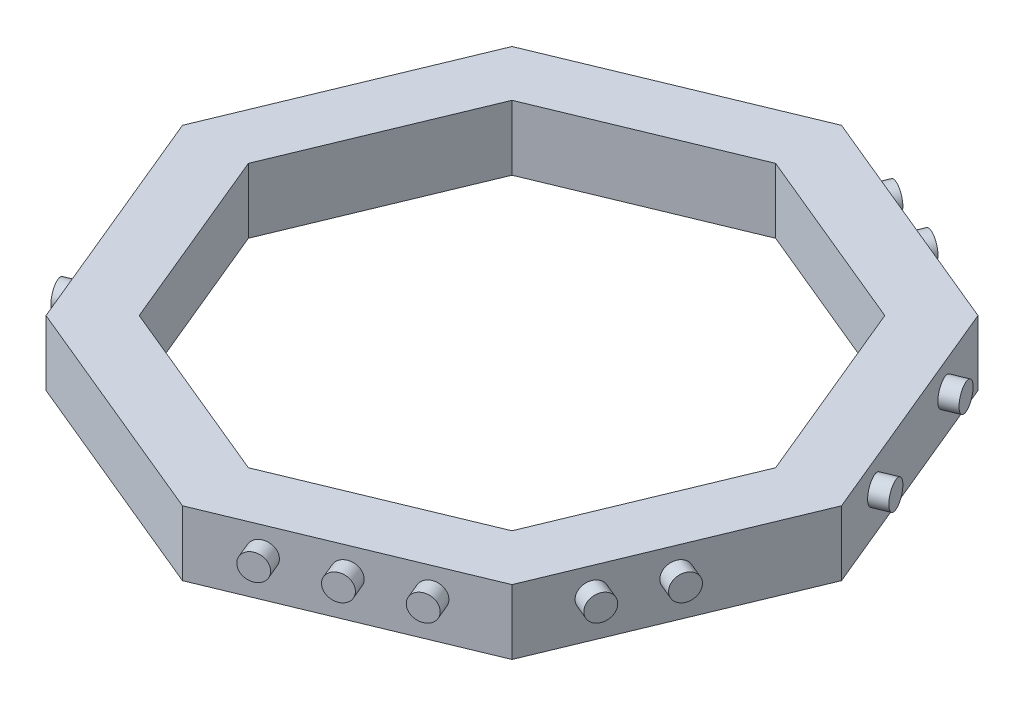
from build123d import *

# Parameters (mm, degrees)
BOSS_EXTRUDE1_DEPTH  = 5
CUT_EXTRUDE1_DEPTH   = 5
SKETCH6_R            = 1
BOSS_EXTRUDE5_DEPTH  = 1.25
SKETCH7_R            = 1
BOSS_EXTRUDE6_DEPTH  = 1.25
SKETCH8_R            = 1
BOSS_EXTRUDE7_DEPTH  = 1.25
BOSS_EXTRUDE8_START  = 1.25
SKETCH9_R            = 1
BOSS_EXTRUDE8_DEPTH  = 1.25
SKETCH10_R           = 1
BOSS_EXTRUDE12_DEPTH = 1.25
BOSS_EXTRUDE13_START = 1.25
SKETCH11_R           = 1
BOSS_EXTRUDE13_DEPTH = 1.25
BOSS_EXTRUDE14_START = 1.25
SKETCH12_R           = 1
BOSS_EXTRUDE14_DEPTH = 1.25


with BuildPart() as part:
    # Sketch3 → Boss-Extrude1 (new body)
    with BuildSketch(Plane(origin=(0, 0, 0), x_dir=(1, 0, 0), z_dir=(0, 1, 0))):
        Polygon((25.4, 0), (17.960512242, 17.960512242), (0, 25.4), (-17.960512242, 17.960512242), (-25.4, 0), (-17.960512242, -17.960512242), (0, -25.4), (17.960512242, -17.960512242), align=None)
    extrude(amount=BOSS_EXTRUDE1_DEPTH)

    # Sketch5 → Cut-Extrude1 (cut)
    with BuildSketch(Plane(origin=(0, 5, 0), x_dir=(1, 0, 0), z_dir=(0, 1, 0))):
        Polygon((20.32, 0), (14.368409794, 14.368409794), (0, 20.32), (-14.368409794, 14.368409794), (-20.32, 0), (-14.368409794, -14.368409794), (0, -20.32), (14.368409794, -14.368409794), align=None)
    extrude(amount=-CUT_EXTRUDE1_DEPTH, mode=Mode.SUBTRACT)

    # Sketch6 → Boss-Extrude5 (add)
    with BuildSketch(Plane(origin=(8.980256121, 0, 21.680256121), x_dir=(0.9238795325112827, 0, -0.38268343236509966), z_dir=(0.38268343236509966, 0, 0.9238795325112827))):
        with Locations(Location((0, 3, 0), (0, 0, 180))):
            Circle(SKETCH6_R)
        with Locations(Location((-5, 3, 0), (0, 0, 180))):
            Circle(SKETCH6_R)
        with Locations(Location((5, 3, 0), (0, 0, 180))):
            Circle(SKETCH6_R)
    extrude(amount=BOSS_EXTRUDE5_DEPTH)

    # Sketch7 → Boss-Extrude6 (add)
    with BuildSketch(Plane(origin=(-21.680256121, 0, 8.980256121), x_dir=(0.3826834323650997, 0, 0.9238795325112827), z_dir=(-0.9238795325112827, 0, 0.3826834323650997))):
        with Locations(Location((5, 3, 0), (0, 0, 180))):
            Circle(SKETCH7_R)
    extrude(amount=BOSS_EXTRUDE6_DEPTH)

    # Sketch8 → Boss-Extrude7 (add)
    with BuildSketch(Plane(origin=(-21.680256121, 0, -8.980256121), x_dir=(-0.3826834323650795, 0, 0.9238795325112911), z_dir=(-0.9238795325112911, 0, -0.3826834323650795))):
        with Locations(Location((0, 3, 0), (0, 0, 180))):
            Circle(SKETCH8_R)
    extrude(amount=BOSS_EXTRUDE7_DEPTH)

    # Sketch9 → Boss-Extrude8 (add)
    with BuildSketch(Plane(origin=(-8.980256121, 0, -21.680256121), x_dir=(-0.9238795325112826, 0, 0.38268343236509983), z_dir=(-0.38268343236509983, 0, -0.9238795325112826)).offset(BOSS_EXTRUDE8_START)):
        with Locations((-5, 3)):
            Circle(SKETCH9_R)
    extrude(amount=-BOSS_EXTRUDE8_DEPTH)

    # Sketch10 → Boss-Extrude12 (add)
    with BuildSketch(Plane(origin=(8.980256121, 0, -21.680256121), x_dir=(-0.923879532511291, 0, -0.38268343236507973), z_dir=(0.38268343236507973, 0, -0.923879532511291))):
        with Locations(Location((0, 3, 0), (0, 0, 180))):
            Circle(SKETCH10_R)
        with Locations(Location((5, 3, 0), (0, 0, 180))):
            Circle(SKETCH10_R)
    extrude(amount=BOSS_EXTRUDE12_DEPTH)

    # Sketch11 → Boss-Extrude13 (add)
    with BuildSketch(Plane(origin=(21.680256121, 0, -8.980256121), x_dir=(-0.3826834323651001, 0, -0.9238795325112825), z_dir=(0.9238795325112824, 0, -0.38268343236510005)).offset(BOSS_EXTRUDE13_START)):
        with Locations(Location((5, 3, 0), (0, 0, 180))):
            Circle(SKETCH11_R)
        with Locations((-5, 3)):
            Circle(SKETCH11_R)
    extrude(amount=-BOSS_EXTRUDE13_DEPTH)

    # Sketch12 → Boss-Extrude14 (add)
    with BuildSketch(Plane(origin=(21.680256121, 0, 8.980256121), x_dir=(0.3826834323650795, 0, -0.923879532511291), z_dir=(0.9238795325112911, 0, 0.38268343236507957)).offset(BOSS_EXTRUDE14_START)):
        with Locations((0, 3)):
            Circle(SKETCH12_R)
        with Locations(Location((-5, 3, 0), (0, 0, 180))):
            Circle(SKETCH12_R)
    extrude(amount=-BOSS_EXTRUDE14_DEPTH)


solid = part.part
